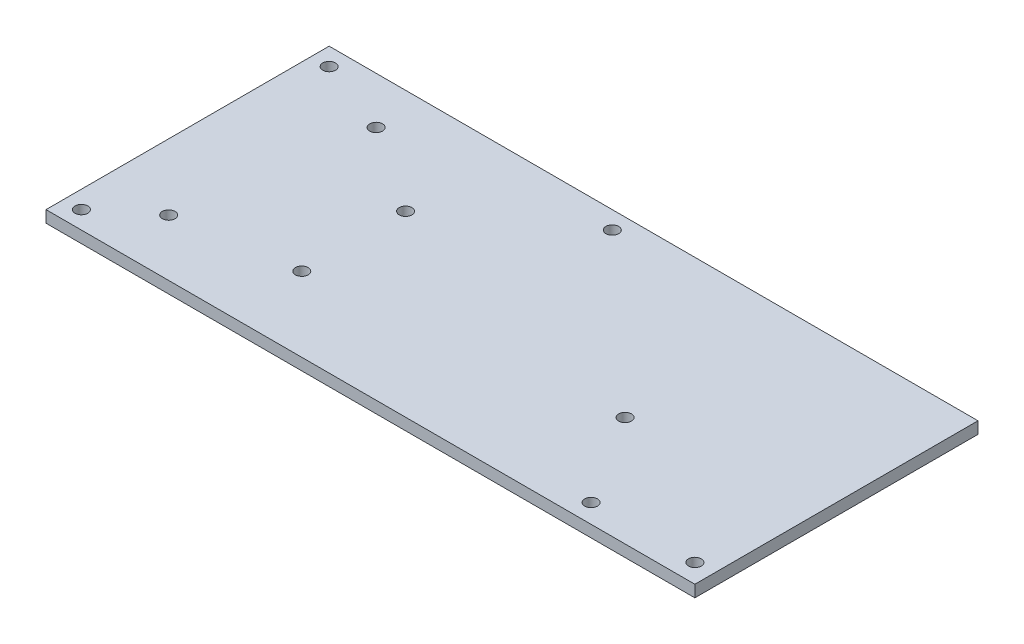
from build123d import *

# Parameters (mm, degrees)
BASE_SKETCH_W                              = 174.625
BASE_SKETCH_H                              = 76.2
BASE_PLATE_DEPTH                           = 3.175
F_4_40_GUIDE_RAIL_HOLES_REACH              = 97.316
F_4_40_HOLE_PATTERN_SKETCH_GUIDE_RAIL_R    = 1.7145
F_4_40_ARDUINO_HOLES_REACH                 = 97.316
F_4_40_HOLE_PATTERN_SKETCH_ARDUINO_HOLES_R = 1.7145
F_4_40_IMU_MOUNT_HOLES_REACH               = 97.316
F_4_40_HOLE_PATTERN_SKETCH_IMU_MOUNT_R     = 1.7145


with BuildPart() as part:
    # Base Sketch → Base Plate (new body)
    with BuildSketch(Plane(origin=(0, 0, 0), x_dir=(1, 0, 0), z_dir=(0, 1, 0))):
        Rectangle(BASE_SKETCH_W, BASE_SKETCH_H)
    extrude(amount=BASE_PLATE_DEPTH)

    # 4-40 Hole Pattern Sketch (Guide Rail) → 4-40 Guide Rail Holes (cut, up to next)
    with BuildSketch(Plane(origin=(0, 3.175, 0), x_dir=(1, 0, 0), z_dir=(0, 1, 0)), mode=Mode.PRIVATE) as f_4_40_guide_rail_holes_sk1:
        with Locations(Location((-82.55, 33.3375, 0), (0, 0, 270))):
            Circle(F_4_40_HOLE_PATTERN_SKETCH_GUIDE_RAIL_R)
    f_4_40_guide_rail_holes_tool1 = extrude(f_4_40_guide_rail_holes_sk1.sketch, amount=-F_4_40_GUIDE_RAIL_HOLES_REACH, mode=Mode.PRIVATE) & part.part
    # 4-40 Hole Pattern Sketch (Guide Rail) → 4-40 Guide Rail Holes (cut, up to next)
    with BuildSketch(Plane(origin=(0, 3.175, 0), x_dir=(1, 0, 0), z_dir=(0, 1, 0)), mode=Mode.PRIVATE) as f_4_40_guide_rail_holes_sk2:
        with Locations(Location((-82.55, -33.3375, 0), (0, 0, 270))):
            Circle(F_4_40_HOLE_PATTERN_SKETCH_GUIDE_RAIL_R)
    f_4_40_guide_rail_holes_tool2 = extrude(f_4_40_guide_rail_holes_sk2.sketch, amount=-F_4_40_GUIDE_RAIL_HOLES_REACH, mode=Mode.PRIVATE) & part.part
    # 4-40 Hole Pattern Sketch (Guide Rail) → 4-40 Guide Rail Holes (cut, up to next)
    with BuildSketch(Plane(origin=(0, 3.175, 0), x_dir=(1, 0, 0), z_dir=(0, 1, 0)), mode=Mode.PRIVATE) as f_4_40_guide_rail_holes_sk3:
        with Locations(Location((-6.35, 33.3375, 0), (0, 0, 270))):
            Circle(F_4_40_HOLE_PATTERN_SKETCH_GUIDE_RAIL_R)
    f_4_40_guide_rail_holes_tool3 = extrude(f_4_40_guide_rail_holes_sk3.sketch, amount=-F_4_40_GUIDE_RAIL_HOLES_REACH, mode=Mode.PRIVATE) & part.part
    add(f_4_40_guide_rail_holes_tool1.solids().sort_by_distance((-82.55, 3.175, -33.3375))[0], mode=Mode.SUBTRACT)
    add(f_4_40_guide_rail_holes_tool2.solids().sort_by_distance((-82.55, 3.175, 33.3375))[0], mode=Mode.SUBTRACT)
    add(f_4_40_guide_rail_holes_tool3.solids().sort_by_distance((-6.35, 3.175, -33.3375))[0], mode=Mode.SUBTRACT)

    # 4-40 Hole Pattern Sketch (Arduino Holes) → 4-40 Arduino Holes (cut, up to next)
    with BuildSketch(Plane(origin=(0, 3.175, 0), x_dir=(1, 0, 0), z_dir=(0, 1, 0)), mode=Mode.PRIVATE) as f_4_40_arduino_holes_sk1:
        with Locations(Location((-38.5445, -18.034, 0), (0, 0, 270))):
            Circle(F_4_40_HOLE_PATTERN_SKETCH_ARDUINO_HOLES_R)
    f_4_40_arduino_holes_tool1 = extrude(f_4_40_arduino_holes_sk1.sketch, amount=-F_4_40_ARDUINO_HOLES_REACH, mode=Mode.PRIVATE) & part.part
    # 4-40 Hole Pattern Sketch (Arduino Holes) → 4-40 Arduino Holes (cut, up to next)
    with BuildSketch(Plane(origin=(0, 3.175, 0), x_dir=(1, 0, 0), z_dir=(0, 1, 0)), mode=Mode.PRIVATE) as f_4_40_arduino_holes_sk2:
        with Locations(Location((-38.5445, 9.906, 0), (0, 0, 270))):
            Circle(F_4_40_HOLE_PATTERN_SKETCH_ARDUINO_HOLES_R)
    f_4_40_arduino_holes_tool2 = extrude(f_4_40_arduino_holes_sk2.sketch, amount=-F_4_40_ARDUINO_HOLES_REACH, mode=Mode.PRIVATE) & part.part
    # 4-40 Hole Pattern Sketch (Arduino Holes) → 4-40 Arduino Holes (cut, up to next)
    with BuildSketch(Plane(origin=(0, 3.175, 0), x_dir=(1, 0, 0), z_dir=(0, 1, 0)), mode=Mode.PRIVATE) as f_4_40_arduino_holes_sk3:
        with Locations(Location((-69.5325, -22.86, 0), (0, 0, 270))):
            Circle(F_4_40_HOLE_PATTERN_SKETCH_ARDUINO_HOLES_R)
    f_4_40_arduino_holes_tool3 = extrude(f_4_40_arduino_holes_sk3.sketch, amount=-F_4_40_ARDUINO_HOLES_REACH, mode=Mode.PRIVATE) & part.part
    # 4-40 Hole Pattern Sketch (Arduino Holes) → 4-40 Arduino Holes (cut, up to next)
    with BuildSketch(Plane(origin=(0, 3.175, 0), x_dir=(1, 0, 0), z_dir=(0, 1, 0)), mode=Mode.PRIVATE) as f_4_40_arduino_holes_sk4:
        with Locations(Location((-62.0395, 25.4762, 0), (0, 0, 270))):
            Circle(F_4_40_HOLE_PATTERN_SKETCH_ARDUINO_HOLES_R)
    f_4_40_arduino_holes_tool4 = extrude(f_4_40_arduino_holes_sk4.sketch, amount=-F_4_40_ARDUINO_HOLES_REACH, mode=Mode.PRIVATE) & part.part
    add(f_4_40_arduino_holes_tool1.solids().sort_by_distance((-38.5445, 3.175, 18.034))[0], mode=Mode.SUBTRACT)
    add(f_4_40_arduino_holes_tool2.solids().sort_by_distance((-38.5445, 3.175, -9.906))[0], mode=Mode.SUBTRACT)
    add(f_4_40_arduino_holes_tool3.solids().sort_by_distance((-69.5325, 3.175, 22.86))[0], mode=Mode.SUBTRACT)
    add(f_4_40_arduino_holes_tool4.solids().sort_by_distance((-62.0395, 3.175, -25.4762))[0], mode=Mode.SUBTRACT)

    # 4-40 Hole Pattern Sketch (IMU Mount) → 4-40 IMU Mount Holes (cut, up to next)
    with BuildSketch(Plane(origin=(0, 3.175, 0), x_dir=(1, 0, 0), z_dir=(0, 1, 0)), mode=Mode.PRIVATE) as f_4_40_imu_mount_holes_sk1:
        with Locations(Location((82.2325, -33.02, 0), (0, 0, 270))):
            Circle(F_4_40_HOLE_PATTERN_SKETCH_IMU_MOUNT_R)
    f_4_40_imu_mount_holes_tool1 = extrude(f_4_40_imu_mount_holes_sk1.sketch, amount=-F_4_40_IMU_MOUNT_HOLES_REACH, mode=Mode.PRIVATE) & part.part
    # 4-40 Hole Pattern Sketch (IMU Mount) → 4-40 IMU Mount Holes (cut, up to next)
    with BuildSketch(Plane(origin=(0, 3.175, 0), x_dir=(1, 0, 0), z_dir=(0, 1, 0)), mode=Mode.PRIVATE) as f_4_40_imu_mount_holes_sk2:
        with Locations(Location((54.2925, -33.02, 0), (0, 0, 270))):
            Circle(F_4_40_HOLE_PATTERN_SKETCH_IMU_MOUNT_R)
    f_4_40_imu_mount_holes_tool2 = extrude(f_4_40_imu_mount_holes_sk2.sketch, amount=-F_4_40_IMU_MOUNT_HOLES_REACH, mode=Mode.PRIVATE) & part.part
    # 4-40 Hole Pattern Sketch (IMU Mount) → 4-40 IMU Mount Holes (cut, up to next)
    with BuildSketch(Plane(origin=(0, 3.175, 0), x_dir=(1, 0, 0), z_dir=(0, 1, 0)), mode=Mode.PRIVATE) as f_4_40_imu_mount_holes_sk3:
        with Locations(Location((39.0525, -8.636, 0), (0, 0, 270))):
            Circle(F_4_40_HOLE_PATTERN_SKETCH_IMU_MOUNT_R)
    f_4_40_imu_mount_holes_tool3 = extrude(f_4_40_imu_mount_holes_sk3.sketch, amount=-F_4_40_IMU_MOUNT_HOLES_REACH, mode=Mode.PRIVATE) & part.part
    add(f_4_40_imu_mount_holes_tool1.solids().sort_by_distance((82.2325, 3.175, 33.02))[0], mode=Mode.SUBTRACT)
    add(f_4_40_imu_mount_holes_tool2.solids().sort_by_distance((54.2925, 3.175, 33.02))[0], mode=Mode.SUBTRACT)
    add(f_4_40_imu_mount_holes_tool3.solids().sort_by_distance((39.0525, 3.175, 8.636))[0], mode=Mode.SUBTRACT)


solid = part.part
